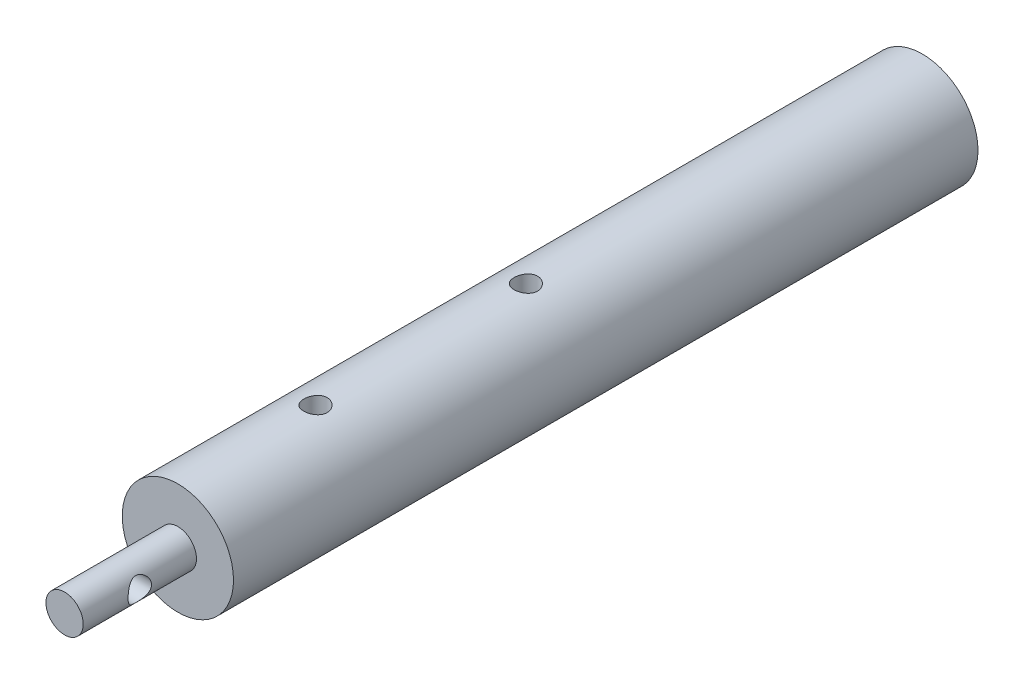
from build123d import *

# Parameters (mm, degrees)
SKETCH1_R             = 8.73125
BOSS_EXTRUDE1_DEPTH   = 116.84
SKETCH2_R             = 2.921
BOSS_EXTRUDE2_DEPTH   = 17.78
F_6_32_TAPPED_HOLE1_D = 2.7051
F_6_32_TAPPED_HOLE2_D = 2.7051
SKETCH4_R             = 1.8415
CUT_EXTRUDE1_DEPTH    = 137.028372284
SKETCH7_R             = 1.8415
CUT_EXTRUDE2_DEPTH    = 136.405147936


with BuildPart() as part:
    # Sketch1 → Boss-Extrude1 (new body)
    with BuildSketch(Plane.XY):
        with Locations(Location((0, 0, 0), (0, 0, 180))):
            Circle(SKETCH1_R)
    extrude(amount=BOSS_EXTRUDE1_DEPTH)

    # Sketch2 → Boss-Extrude2 (add)
    with BuildSketch(Plane.XY.offset(116.84)):
        Circle(SKETCH2_R)
    extrude(amount=BOSS_EXTRUDE2_DEPTH)

    # #6-32 Tapped Hole1 (through all)
    with Locations(Plane(origin=(0, 8.73125, 0), x_dir=(1, 0, 0), z_dir=(0, 1, 0))):
        with Locations((0, -62.23), (0, -95.25)):
            Hole(F_6_32_TAPPED_HOLE1_D / 2)

    # #6-32 Tapped Hole2 (through all)
    with Locations(Plane(origin=(2.921, 0, 0), x_dir=(0, 0, -1), z_dir=(1, 0, 0))):
        with Locations((-125.73, 0)):
            Hole(F_6_32_TAPPED_HOLE2_D / 2)

    # Sketch4 → Cut-Extrude1 (cut, through all)
    with BuildSketch(Plane(origin=(0, 8.73125, 0), x_dir=(1, 0, 0), z_dir=(0, 1, 0))):
        with Locations(Location((0, -62.23, 0), (0, 0, 270))):
            Circle(SKETCH4_R)
        with Locations(Location((0, -95.25, 0), (0, 0, 270))):
            Circle(SKETCH4_R)
    extrude(amount=-CUT_EXTRUDE1_DEPTH, mode=Mode.SUBTRACT)

    # Sketch7 → Cut-Extrude2 (cut, through all)
    with BuildSketch(Plane(origin=(2.921, 0, 0), x_dir=(0, 0, -1), z_dir=(1, 0, 0))):
        with Locations(Location((-125.73, 0, 0), (0, 0, 180))):
            Circle(SKETCH7_R)
    extrude(amount=-CUT_EXTRUDE2_DEPTH, mode=Mode.SUBTRACT)


solid = part.part
